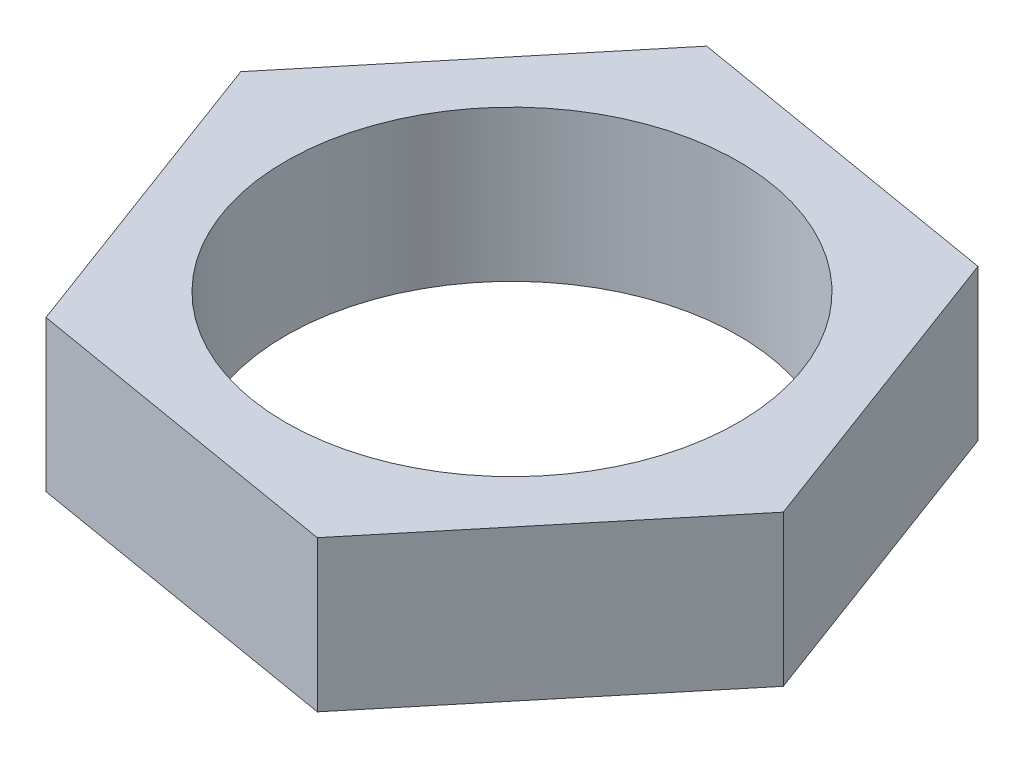
from build123d import *

# Parameters (mm, degrees)
SZKIC1_R                    = 7.5
DODANIE_WYCI_GNI_CIE1_DEPTH = 5


with BuildPart() as part:
    # Szkic1 → Dodanie-wyciągnięcie1 (new body)
    with BuildSketch(Plane(origin=(0, 0, 0), x_dir=(1, 0, 0), z_dir=(0, 1, 0))):
        Polygon((-10.816724638, 1.825322283), (-6.989137786, -8.454897181), (3.827586852, -10.280219464), (10.816724638, -1.825322283), (6.989137786, 8.454897181), (-3.827586852, 10.280219464), align=None)
        with Locations(Location((0, 0, 0), (0, 0, 270))):
            Circle(SZKIC1_R, mode=Mode.SUBTRACT)
    extrude(amount=DODANIE_WYCI_GNI_CIE1_DEPTH)


solid = part.part
